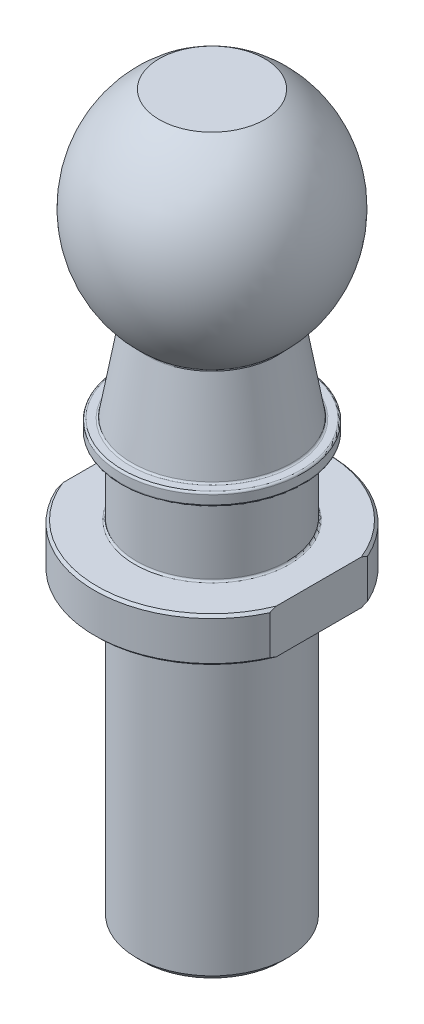
from build123d import *

# Parameters (mm, degrees)
FILETE3_R             = 0.15
CHANFRO1_SIZE         = 0.2
FILETE4_R             = 0.15
CHANFRO2_SIZE         = 0.5
ESBO_O2_W             = 3.197322634
ESBO_O2_H             = 24.687653755
CORTE_EXTRUS_O1_DEPTH = 33.510536845
CORTE_EXTRUS_O2_DEPTH = 5


with BuildPart() as part:
    # Esboço1 → Revolução1 (revolve)
    with BuildSketch(Plane.XY, mode=Mode.PRIVATE) as revolu_o1_sk:
        with BuildLine():
            Line((0, -52.958859358), (6, -52.958859358))
            Line((6, -52.958859358), (6, -28.758859358))
            Line((6, -28.758859358), (9.35, -28.758859358))
            Line((9.35, -28.758859358), (9.35, -25.258859358))
            Line((9.35, -25.258859358), (6, -25.258859358))
            Line((6, -25.258859358), (6, -19.258859358))
            Line((6, -19.258859358), (7.25, -19.258859358))
            Line((7.25, -19.258859358), (7.25, -18.258859358))
            Line((7.25, -18.258859358), (6.4, -18.258859358))
            Line((6.4, -18.258859358), (5.175, -11.258859358))
            ThreePointArc((5.175, -11.258859358), (8.710814676, -3.159668157), (4.202312805, 4.441140642))
            Line((4.202312805, 4.441140642), (0, 4.441140642))
            Line((0, 4.441140642), (0, -52.958859358))
        make_face()
    revolve(revolu_o1_sk.sketch.rotate(Axis((0, 52.480675526, 0), (0, -1, 0)), 90), axis=Axis((0, 52.480675526, 0), (0, -1, 0)))

    # Filete3
    filete3_edges = [part.edges().sort_by_distance(p)[0] for p in [
        (0, -18.258859358, -6.4),
        (0, -18.258859358, -7.25),
        (0, -19.258859358, -7.25),
        (0, -19.258859358, -6),
        (0, -11.258859358, -5.175),
    ]]
    fillet(filete3_edges, radius=FILETE3_R)

    # Chanfro1
    chanfro1_edges = [part.edges().sort_by_distance(p)[0] for p in [
        (0, -25.258859358, -9.35),
        (0, -28.758859358, -9.35),
    ]]
    chamfer(chanfro1_edges, length=CHANFRO1_SIZE)

    # Filete4
    filete4_edges = [part.edges().sort_by_distance(p)[0] for p in [
        (0, -25.258859358, -6),
    ]]
    fillet(filete4_edges, radius=FILETE4_R)

    # Chanfro2
    chanfro2_edges = [part.edges().sort_by_distance(p)[0] for p in [
        (0, -52.958859358, -6),
    ]]
    chamfer(chanfro2_edges, length=CHANFRO2_SIZE)

    # Esboço2 → Corte-extrusão1 (cut, through all)
    with BuildSketch(Plane(origin=(0, -25.258859358, 0), x_dir=(1, 0, 0), z_dir=(0, 1, 0))):
        with Locations((10.098661317, -1.391001442)):
            Rectangle(ESBO_O2_W, ESBO_O2_H)
        with Locations((-10.098661317, -1.391001442)):
            Rectangle(ESBO_O2_W, ESBO_O2_H)
    extrude(amount=-CORTE_EXTRUS_O1_DEPTH, mode=Mode.SUBTRACT)

    # Esboço3 → Corte-extrusão2 (cut)
    with BuildSketch(Plane.XZ.offset(52.958859358)):
        Polygon((0.577706431, 2.8283544), (-2.160573546, 1.914485645), (-2.738279977, -0.913868755), (-0.577706431, -2.8283544), (2.160573546, -1.914485645), (2.738279977, 0.913868755), align=None)
    extrude(amount=-CORTE_EXTRUS_O2_DEPTH, mode=Mode.SUBTRACT)


solid = part.part
